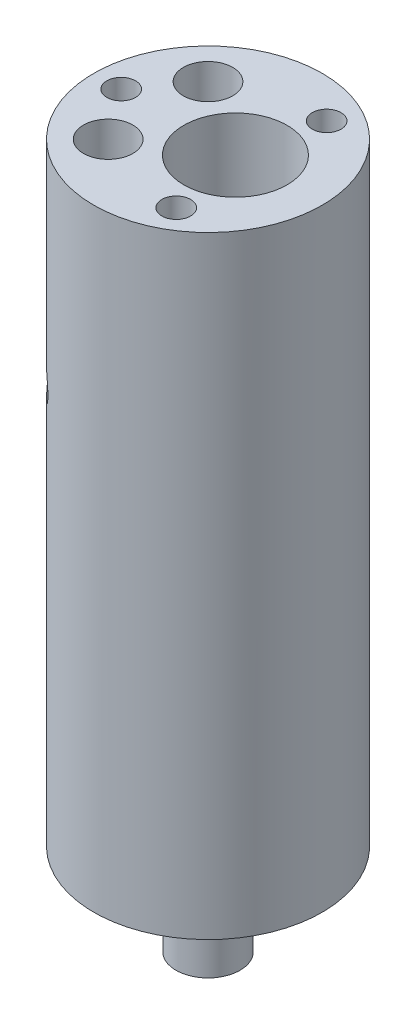
from build123d import *

# Parameters (mm, degrees)
SKETCH1_R                        = 12.5
SKETCH1_R_2                      = 5.65
BOSS_EXTRUDE1_DEPTH              = 60
F_6_0MM_DOWEL_HOLE1_D            = 5.4
F_6_0MM_DOWEL_HOLE1_DEPTH        = 10
TAP_DRILL_FOR_M3_HELICOIL1_D     = 3.15
TAP_DRILL_FOR_M3_HELICOIL1_DEPTH = 10
BOSS_EXTRUDE2_START              = 7
SKETCH17_R                       = 12.5
BOSS_EXTRUDE2_DEPTH              = 7
SKETCH18_R                       = 3.5
BOSS_EXTRUDE3_DEPTH              = 10
SKETCH20_W                       = 1.65
SKETCH20_H                       = 10
F_3_0MM_DOWEL_HOLE2_D            = 3.3
SKETCH24_R                       = 1.65
SKETCH27_R                       = 1.65
F_6_0MM_DOWEL_HOLE2_REACH        = 71.293
F_6_0MM_DOWEL_HOLE2_BORE_R       = 1.65
F_6_0MM_DOWEL_HOLE3_REACH        = 71.293
F_6_0MM_DOWEL_HOLE3_BORE_R       = 1.65
F_6_0MM_DOWEL_HOLE4_D            = 3
F_6_0MM_DOWEL_HOLE4_DEPTH        = 10


with BuildPart() as part:
    # Sketch1 → Boss-Extrude1 (new body)
    with BuildSketch(Plane(origin=(0, 0, 0), x_dir=(1, 0, 0), z_dir=(0, 1, 0))):
        with Locations(Location((0, 0, 0), (0, 0, 270))):
            Circle(SKETCH1_R)
        with Locations(Location((3, 0, 0), (0, 0, 270))):
            Circle(SKETCH1_R_2, mode=Mode.SUBTRACT)
    extrude(amount=BOSS_EXTRUDE1_DEPTH)

    # Ø6.0mm Dowel Hole1
    with Locations(Plane(origin=(0, 60, 0), x_dir=(1, 0, 0), z_dir=(0, 1, 0))):
        with Locations((-5.462566323, 5.462566323), (-5.462566323, -5.462566323)):
            Hole(F_6_0MM_DOWEL_HOLE1_D / 2, depth=F_6_0MM_DOWEL_HOLE1_DEPTH)

    # Tap Drill for M3 Helicoil1
    with Locations(Plane(origin=(0, 60, 0), x_dir=(1, 0, 0), z_dir=(0, 1, 0))):
        with Locations((4.75, 8.227241336), (4.75, -8.227241336), (-9.5, 0)):
            Hole(TAP_DRILL_FOR_M3_HELICOIL1_D / 2, depth=TAP_DRILL_FOR_M3_HELICOIL1_DEPTH)

    # Sketch17 → Boss-Extrude2 (add)
    with BuildSketch(Plane.XZ.offset(BOSS_EXTRUDE2_START)):
        with Locations(Location((0, 0, 0), (0, 0, 270))):
            Circle(SKETCH17_R)
    extrude(amount=-BOSS_EXTRUDE2_DEPTH)

    # Sketch18 → Boss-Extrude3 (add)
    with BuildSketch(Plane.XZ.offset(7)):
        with Locations(Location((0, 0, 0), (0, 0, 270))):
            Circle(SKETCH18_R)
    extrude(amount=BOSS_EXTRUDE3_DEPTH)

    # Sketch20 → Ø3.0mm Dowel Hole1 (revolve, cut)
    with BuildSketch(Plane(origin=(0, -7, 0), x_dir=(0, 0, 1), z_dir=(1, 0, 0))):
        with Locations((0.825, 5)):
            Rectangle(SKETCH20_W, SKETCH20_H)
    revolve(axis=Axis((0, -0.65, 0), (0, -1, 0)), mode=Mode.SUBTRACT)

    # Ø3.0mm Dowel Hole2 (through all)
    with Locations(Plane(origin=(0, 0, 0), x_dir=(1, 0, 0), z_dir=(0, 1, 0))):
        with Locations((0, 0)):
            Hole(F_3_0MM_DOWEL_HOLE2_D / 2)

    # Cut-Sweep5: sweep along a curve in space
    with BuildLine() as cut_sweep5_path:
        Line((0, 24.869183639, 0), (-8.875394659, 37.420887137, -8.875394659))
    # Sketch24 → Cut-Sweep5 (sweep, cut)
    with BuildSketch(Plane(origin=(-8.838834765, 0, -8.838834765), x_dir=(-0.7071067811865462, 0, 0.7071067811865488), z_dir=(-0.7071067811865488, 0, -0.7071067811865462))):
        with Locations((0, 36.882111372)):
            Circle(SKETCH24_R)
    sweep(path=cut_sweep5_path.line, mode=Mode.SUBTRACT)

    # Cut-Sweep6: sweep along a curve in space
    with BuildLine() as cut_sweep6_path:
        Line((-3.623287534, 30, 3.623287534), (-12.526142338, 42.590538007, 12.526142338))
        Line((-3.623287534, 30, 3.623287534), (0, 24.875897629, 0))
    # Sketch27 → Cut-Sweep6 (sweep, cut)
    with BuildSketch(Plane(origin=(-8.838834765, 0, 8.838834765), x_dir=(0.7071067811865488, 0, 0.7071067811865462), z_dir=(-0.7071067811865462, 0, 0.7071067811865488))):
        with Locations((0, 36.98969213)):
            Circle(SKETCH27_R)
    sweep(path=cut_sweep6_path.line, mode=Mode.SUBTRACT)

    # Ø6.0mm Dowel Hole2 bore → Ø6.0mm Dowel Hole2 (cut, up to next)
    with BuildSketch(Plane(origin=(0, 50, 0), x_dir=(1, 0, 0), z_dir=(0, 1, 0)), mode=Mode.PRIVATE) as f_6_0mm_dowel_hole2_sk1:
        with Locations((-5.462566323, 5.462566323)):
            Circle(F_6_0MM_DOWEL_HOLE2_BORE_R)
    f_6_0mm_dowel_hole2_tool1 = extrude(f_6_0mm_dowel_hole2_sk1.sketch, amount=-F_6_0MM_DOWEL_HOLE2_REACH, mode=Mode.PRIVATE) & part.part
    add(f_6_0mm_dowel_hole2_tool1.solids().sort_by_distance((-5.462566, 50, -5.462566))[0], mode=Mode.SUBTRACT)

    # Ø6.0mm Dowel Hole3 bore → Ø6.0mm Dowel Hole3 (cut, up to next)
    with BuildSketch(Plane(origin=(0, 50, 0), x_dir=(1, 0, 0), z_dir=(0, 1, 0)), mode=Mode.PRIVATE) as f_6_0mm_dowel_hole3_sk1:
        with Locations((-5.462566323, -5.462566323)):
            Circle(F_6_0MM_DOWEL_HOLE3_BORE_R)
    f_6_0mm_dowel_hole3_tool1 = extrude(f_6_0mm_dowel_hole3_sk1.sketch, amount=-F_6_0MM_DOWEL_HOLE3_REACH, mode=Mode.PRIVATE) & part.part
    add(f_6_0mm_dowel_hole3_tool1.solids().sort_by_distance((-5.462566, 50, 5.462566))[0], mode=Mode.SUBTRACT)

    # Ø6.0mm Dowel Hole4
    with Locations(Plane(origin=(0, -7, 0), x_dir=(-1, 0, 0), z_dir=(0, -1, 0))):
        with Locations((-4.5, -7.794228634), (9, 0), (-4.5, 7.794228634)):
            Hole(F_6_0MM_DOWEL_HOLE4_D / 2, depth=F_6_0MM_DOWEL_HOLE4_DEPTH)


solid = part.part
